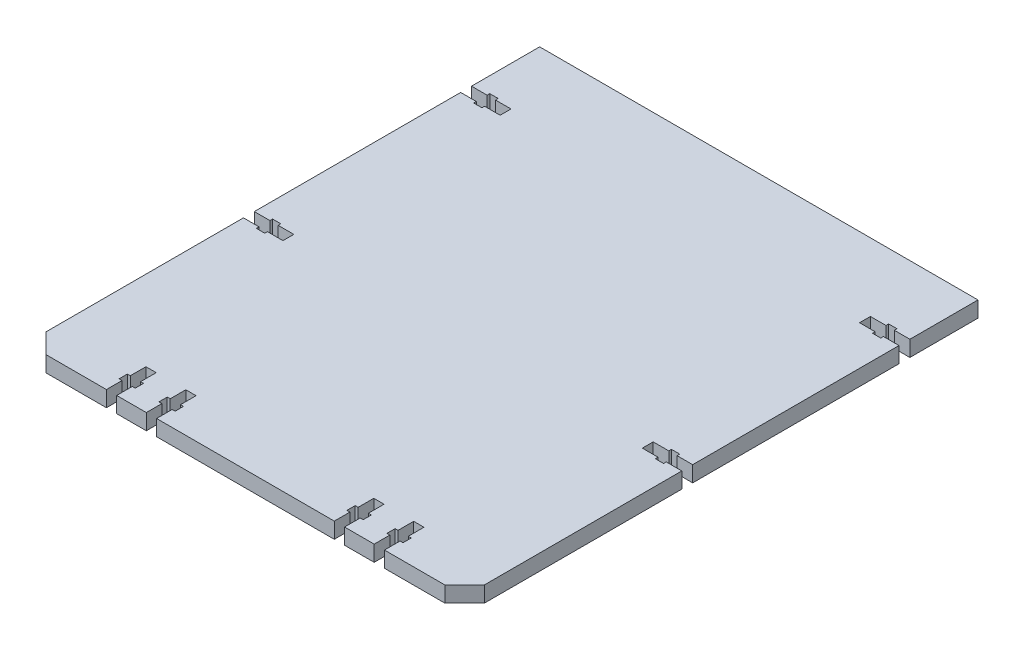
from build123d import *

# Parameters (mm, degrees)
EXTRUDE_1_DEPTH = 8
CHAMFER_1_SIZE  = 10


with BuildPart() as part:
    # Эскиз2 → Бобышка-Вытянуть1 (new body)
    with BuildSketch(Plane(origin=(0, 0, 0), x_dir=(1, 0, 0), z_dir=(0, 1, 0))):
        Polygon((-111, 110), (-111, 0), (-70.4, 0), (-70.4, 7.9), (-71.9, 7.9), (-71.9, 12.1), (-70.4, 12.1), (-70.4, 20), (-65.2, 20), (-65.2, 12.1), (-63.7, 12.1), (-63.7, 7.9), (-65.2, 7.9), (-65.2, 0), (-50.2, 0), (-50.2, 7.9), (-51.7, 7.9), (-51.7, 12.1), (-50.2, 12.1), (-50.2, 20), (-45, 20), (-45, 12.1), (-43.5, 12.1), (-43.5, 7.9), (-45, 7.9), (-45, 0), (45, 0), (45, 7.9), (43.5, 7.9), (43.5, 12.1), (45, 12.1), (45, 20), (50.2, 20), (50.2, 12.1), (51.7, 12.1), (51.7, 7.9), (50.2, 7.9), (50.2, 0), (65.2, 0), (65.2, 7.9), (63.7, 7.9), (63.7, 12.1), (65.2, 12.1), (65.2, 20), (70.4, 20), (70.4, 12.1), (71.9, 12.1), (71.9, 7.9), (70.4, 7.9), (70.4, 0), (111, 0), (111, 110), (103.1, 110), (103.1, 108.65), (98.9, 108.65), (98.9, 110), (91, 110), (91, 115.5), (98.9, 115.5), (98.9, 116.85), (103.1, 116.85), (103.1, 115.5), (111, 115.5), (111, 220), (103.1, 220), (103.1, 218.65), (98.9, 218.65), (98.9, 220), (91, 220), (91, 225.5), (98.9, 225.5), (98.9, 226.85), (103.1, 226.85), (103.1, 225.5), (111, 225.5), (111, 260), (-111, 260), (-111, 225.5), (-103.1, 225.5), (-103.1, 226.85), (-98.9, 226.85), (-98.9, 225.5), (-91, 225.5), (-91, 220), (-98.9, 220), (-98.9, 218.65), (-103.1, 218.65), (-103.1, 220), (-111, 220), (-111, 115.5), (-103.1, 115.5), (-103.1, 116.85), (-98.9, 116.85), (-98.9, 115.5), (-91, 115.5), (-91, 110), (-98.9, 110), (-98.9, 108.65), (-103.1, 108.65), (-103.1, 110), align=None)
    extrude(amount=EXTRUDE_1_DEPTH)

    # Фаска1
    chamfer_1_edges = [part.edges().sort_by_distance(p)[0] for p in [
        (111, 4, 0),
        (-111, 4, 0),
    ]]
    chamfer(chamfer_1_edges, length=CHAMFER_1_SIZE)


solid = part.part
